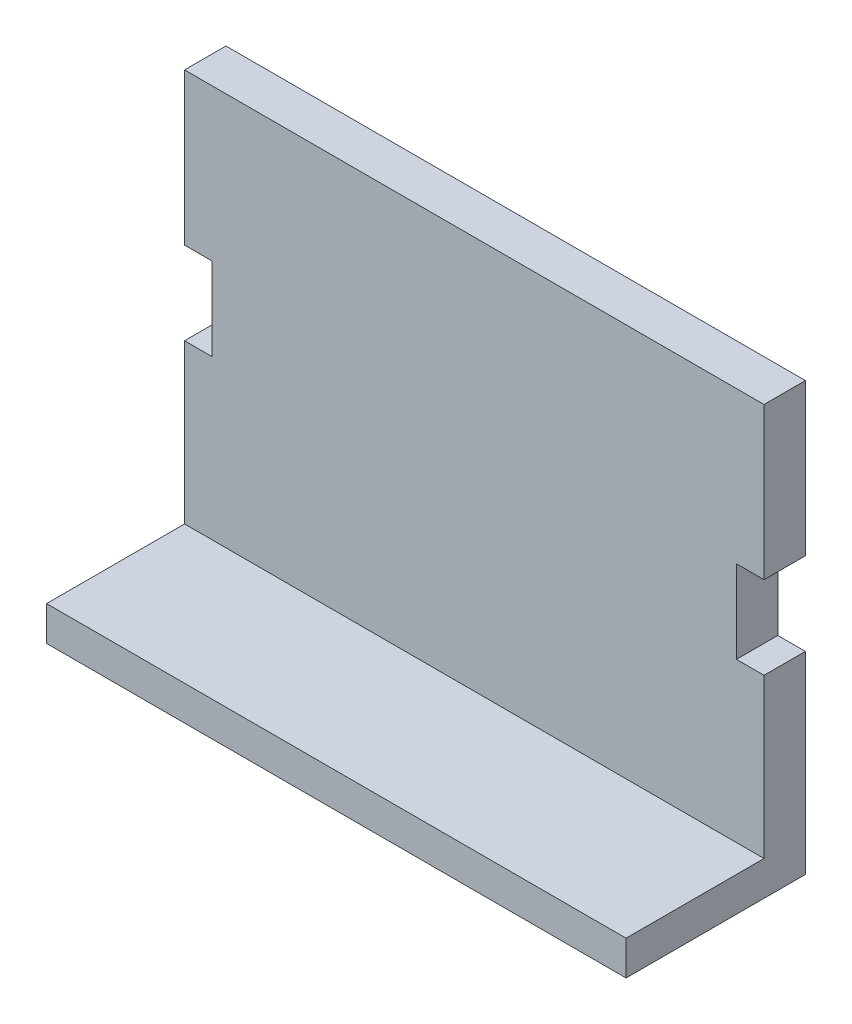
from build123d import *

# Parameters (mm, degrees)
BOSS_EXTRUDE1_DEPTH = 6
SKETCH2_W           = 84
SKETCH2_H           = 5
BOSS_EXTRUDE2_DEPTH = 20


with BuildPart() as part:
    # Sketch1 → Boss-Extrude1 (new body)
    with BuildSketch(Plane.XY):
        Polygon((84, 62), (84, 40), (80, 40), (80, 28), (84, 28), (84, 0), (0, 0), (0, 28), (4, 28), (4, 40), (0, 40), (0, 62), align=None)
    extrude(amount=BOSS_EXTRUDE1_DEPTH)

    # Sketch2 → Boss-Extrude2 (add)
    with BuildSketch(Plane.XY.offset(6)):
        with Locations((42, 2.5)):
            Rectangle(SKETCH2_W, SKETCH2_H)
    extrude(amount=BOSS_EXTRUDE2_DEPTH)


solid = part.part
